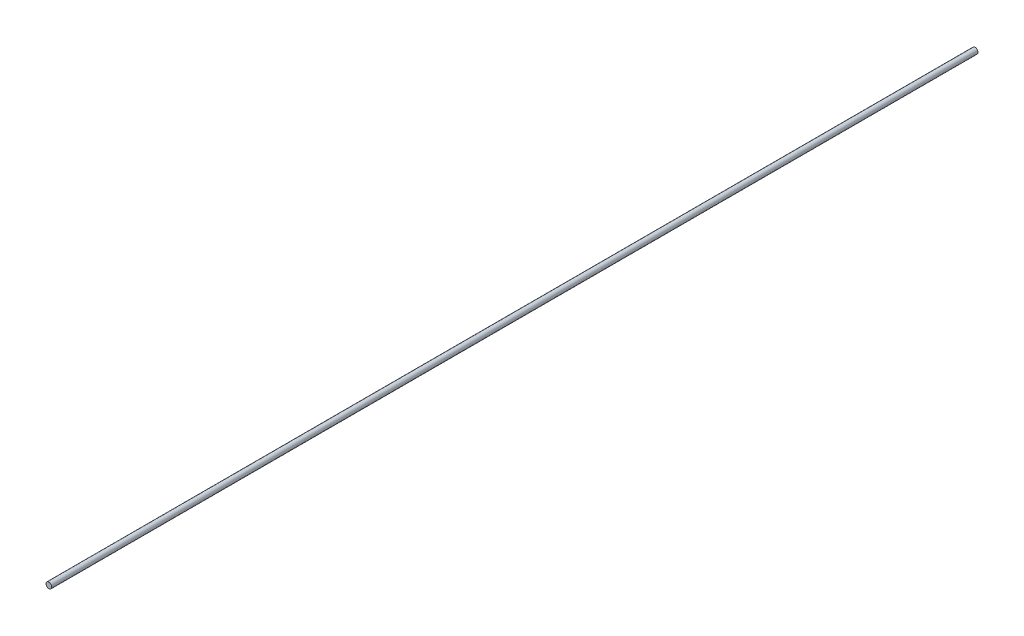
from build123d import *

# Parameters (mm, degrees)
SKETCH_1_R           = 0.4
D0P8_L128_6976_DEPTH = 128.697582912


with BuildPart() as part:
    # 草图1 → D0p8钢索跨度_L128.6976 (new body)
    with BuildSketch(Plane.XY):
        Circle(SKETCH_1_R)
    extrude(amount=D0P8_L128_6976_DEPTH)


solid = part.part
